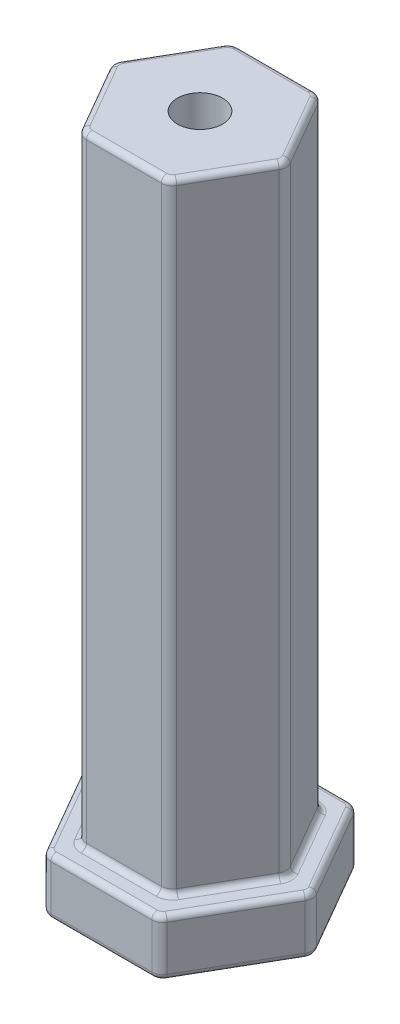
from build123d import *

# Parameters (mm, degrees)
BOSS_EXTRUDE1_DEPTH       = 55
BOSS_EXTRUDE2_DEPTH       = 5
F_4_0MM_DOWEL_HOLE1_D     = 4
F_4_0MM_DOWEL_HOLE1_DEPTH = 20
F_4_0MM_DOWEL_HOLE1_TIP   = 1.201721238
FILLET3_R                 = 1
FILLET4_R                 = 1
FILLET5_R                 = 0.5
FILLET6_R                 = 0.5


with BuildPart() as part:
    # Sketch1 → Boss-Extrude1 (new body)
    with BuildSketch(Plane(origin=(0, 0, 0), x_dir=(1, 0, 0), z_dir=(0, 1, 0))):
        Polygon((3.897114317, -6.75), (7.794228634, 0), (3.897114317, 6.75), (-3.897114317, 6.75), (-7.794228634, 0), (-3.897114317, -6.75), align=None)
    extrude(amount=BOSS_EXTRUDE1_DEPTH)

    # Sketch2 → Boss-Extrude2 (add)
    with BuildSketch(Plane.XZ):
        Polygon((5.051814855, -8.75), (10.103629711, 0), (5.051814855, 8.75), (-5.051814855, 8.75), (-10.103629711, 0), (-5.051814855, -8.75), align=None)
    extrude(amount=BOSS_EXTRUDE2_DEPTH)

    # Ø4.0mm Dowel Hole1
    with Locations(Plane(origin=(0, 55, 0), x_dir=(1, 0, 0), z_dir=(0, 1, 0))):
        with Locations((0, 0)):
            Hole(F_4_0MM_DOWEL_HOLE1_D / 2, depth=F_4_0MM_DOWEL_HOLE1_DEPTH)
            with Locations((0, 0, -(F_4_0MM_DOWEL_HOLE1_DEPTH + F_4_0MM_DOWEL_HOLE1_TIP / 2))):  # 118° drill point
                Cone(0, F_4_0MM_DOWEL_HOLE1_D / 2, F_4_0MM_DOWEL_HOLE1_TIP, mode=Mode.SUBTRACT)

    # Fillet3
    fillet3_edges = [part.edges().sort_by_distance(p)[0] for p in [
        (-3.897114317, 27.5, 6.75),
        (-7.794228634, 27.5, 0),
        (-3.897114317, 27.5, -6.75),
        (3.897114317, 27.5, -6.75),
        (7.794228634, 27.5, 0),
        (3.897114317, 27.5, 6.75),
    ]]
    fillet(fillet3_edges, radius=FILLET3_R)

    # Fillet4
    fillet4_edges = [part.edges().sort_by_distance(p)[0] for p in [
        (-5.051814855, -2.5, -8.75),
        (5.051814855, -2.5, -8.75),
        (10.103629711, -2.5, 0),
        (5.051814855, -2.5, 8.75),
        (-5.051814855, -2.5, 8.75),
        (-10.103629711, -2.5, 0),
    ]]
    fillet(fillet4_edges, radius=FILLET4_R)

    # Fillet5
    fillet5_edges = [part.edges().sort_by_distance(p)[0] for p in [
        (4.974464586, -5, 8.616025404),
        (9.948929172, -5, 0),
        (4.974464586, -5, -8.616025404),
        (-5.845671476, 0, -3.375),
        (0, 0, -6.75),
        (5.845671476, 0, -3.375),
        (5.845671476, 0, 3.375),
        (0, 0, 6.75),
        (-5.845671476, 0, 3.375),
        (-3.819764048, 0, -6.616025404),
        (3.819764048, 0, -6.616025404),
        (7.639528096, 0, 0),
        (3.819764048, 0, 6.616025404),
        (-3.819764048, 0, 6.616025404),
        (-7.639528096, 0, 0),
        (7.577722283, 0, -4.375),
        (7.577722283, -5, -4.375),
        (0, 0, -8.75),
        (-7.577722283, 0, -4.375),
        (-7.577722283, 0, 4.375),
        (0, 0, 8.75),
        (7.577722283, 0, 4.375),
        (-4.974464586, 0, -8.616025404),
        (-9.948929172, 0, 0),
        (-4.974464586, 0, 8.616025404),
        (4.974464586, 0, 8.616025404),
        (9.948929172, 0, 0),
        (4.974464586, 0, -8.616025404),
        (0, -5, -8.75),
        (7.577722283, -5, 4.375),
        (0, -5, 8.75),
        (-7.577722283, -5, 4.375),
        (-7.577722283, -5, -4.375),
        (-4.974464586, -5, -8.616025404),
        (-9.948929172, -5, 0),
        (-4.974464586, -5, 8.616025404),
    ]]
    fillet(fillet5_edges, radius=FILLET5_R)

    # Fillet6
    fillet6_edges = [part.edges().sort_by_distance(p)[0] for p in [
        (-5.845671476, 55, -3.375),
        (0, 55, -6.75),
        (0, 55, 6.75),
        (5.845671476, 55, 3.375),
        (5.845671476, 55, -3.375),
        (-5.845671476, 55, 3.375),
        (-7.639528096, 55, 0),
        (-3.819764048, 55, 6.616025404),
        (3.819764048, 55, 6.616025404),
        (7.639528096, 55, 0),
        (3.819764048, 55, -6.616025404),
        (-3.819764048, 55, -6.616025404),
    ]]
    fillet(fillet6_edges, radius=FILLET6_R)


solid = part.part
